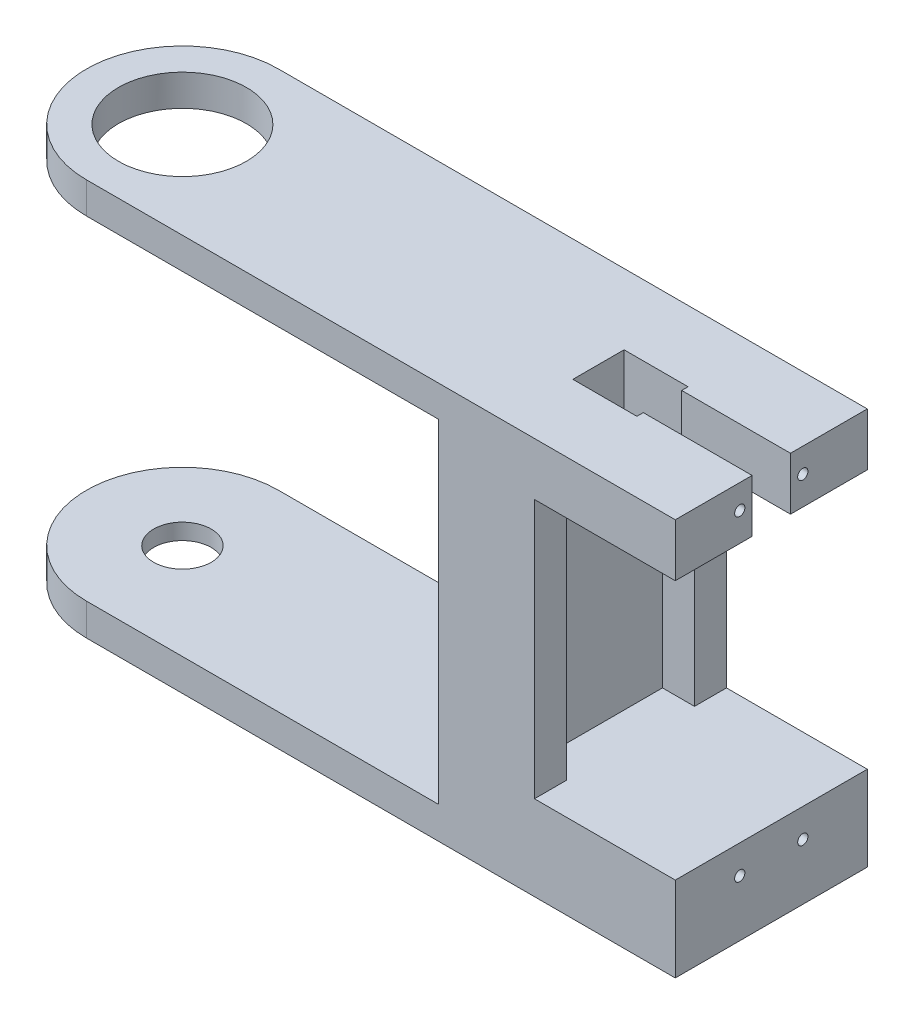
from build123d import *

# Parameters (mm, degrees)
ESQUISSE1_W               = 60.5
ESQUISSE1_H               = 64
BOSS_EXTRU_1_DEPTH        = 30
ESQUISSE2_R               = 4.5
ENL_V_MAT_EXTRU_1_DEPTH   = 32
ENL_V_MAT_EXTRU_2_REACH   = 55.283
ESQUISSE4_W               = 51.1
ESQUISSE4_H               = 83.557669167
ESQUISSE5_R               = 10.5
ENL_V_MAT_EXTRU_3_DEPTH   = 2
ESQUISSE6_R               = 10
ENL_V_MAT_EXTRU_4_DEPTH   = 4.7
ESQUISSE7_W               = 47
ESQUISSE7_H               = 57
BOSS_EXTRU_2_DEPTH        = 30
ENL_V_MAT_EXTRU_5_DEPTH   = 30
ENL_V_MAT_EXTRU_6_DEPTH   = 8.25
ESQUISSE11_W              = 5
ESQUISSE11_H              = 40.5
BOSS_EXTRU_3_DEPTH        = 5
ESQUISSE12_R              = 0.5
ENL_V_MAT_EXTRU_7_DEPTH   = 15
TROU_TARAUD_M2X0_42_D     = 1.6
TROU_TARAUD_M2X0_42_DEPTH = 17
TROU_TARAUD_M2X0_42_TIP   = 0.480688495
ENL_V_MAT_EXTRU_8_REACH   = 113.72
ESQUISSE22_W              = 82.97203866
ESQUISSE22_H              = 67.875780224
ENL_V_MAT_EXTRU_10_DEPTH  = 30
ESQUISSE23_W              = 55
ESQUISSE23_H              = 5
ESQUISSE23_H_2            = 4.9
BOSS_EXTRU_4_DEPTH        = 30
ENL_V_START               = -62
ESQUISSE24_R              = 10
ENL_V_MAT_EXTRU_11_DEPTH  = 62
ENL_V_MAT_EXTRU_12_REACH  = 111.597
ESQUISSE26_R              = 10.5
ESQUISSE26_R_2            = 4.5
BOSS_EXTRU_5_DEPTH        = 5
ESQUISSE27_R              = 10.5
ENL_V_MAT_EXTRU_13_DEPTH  = 2.5
ESQUISSE28_W              = 21.53784572
ESQUISSE28_H              = 33.22443827
ENL_V_MAT_EXTRU_14_DEPTH  = 5
ESQUISSE29_W              = 5
ESQUISSE29_H              = 52.1
ENL_V_MAT_EXTRU_15_DEPTH  = 30
BOSS_EXTRU_6_DEPTH        = 62
ENL_V_START_2             = -20.388398
ESQUISSE32_W              = 38.789198293
ESQUISSE32_H              = 52.1
ENL_V_MAT_EXTRU_16_DEPTH  = 20.388398
ESQUISSE36_W              = 70.879809572
ESQUISSE36_H              = 44.299384872
ENL_V_MAT_EXTRU_20_DEPTH  = 62
ESQUISSE37_W              = 30
ESQUISSE37_H              = 4.9
ESQUISSE37_H_2            = 5
BOSS_EXTRU_8_DEPTH        = 70
ENL_V_MAT_EXTRU_21_REACH  = 119.544
ESQUISSE38_R              = 4.5
ESQUISSE39_R              = 10
ENL_V_MAT_EXTRU_22_DEPTH  = 4.9
ESQUISSE40_R              = 10.5
ENL_V_MAT_EXTRU_23_DEPTH  = 2.5
ENL_V_MAT_EXTRU_24_REACH  = 119.544


with BuildPart() as part:
    # Esquisse1 → Boss.-Extru.1 (new body)
    with BuildSketch(Plane.XY):
        Rectangle(ESQUISSE1_W, ESQUISSE1_H)
    extrude(amount=BOSS_EXTRU_1_DEPTH)

    # Esquisse2 → Enlèv. mat.-Extru.1 (cut)
    with BuildSketch(Plane(origin=(30.25, 0, 0), x_dir=(0, 0, -1), z_dir=(1, 0, 0))):
        with Locations(Location((-15, -17, 0), (0, 0, 90))):
            Circle(ESQUISSE2_R)
    extrude(amount=-ENL_V_MAT_EXTRU_1_DEPTH, mode=Mode.SUBTRACT)

    # Enlèv. mat.-Extru.2: up to this face of the body (flat: up to its plane)
    enl_v_mat_extru_2_end = Plane(part.part.faces().sort_by_distance((0, 0, 0))[0])
    # Esquisse4 → Enlèv. mat.-Extru.2 (cut, up to the picked face)
    with BuildSketch(Plane.XY.offset(30), mode=Mode.PRIVATE) as enl_v_mat_extru_2_sk1:
        with Locations((0, -14.778834584)):
            Rectangle(ESQUISSE4_W, ESQUISSE4_H)
    enl_v_mat_extru_2_tool1 = split(extrude(enl_v_mat_extru_2_sk1.sketch, amount=-ENL_V_MAT_EXTRU_2_REACH, mode=Mode.PRIVATE), bisect_by=enl_v_mat_extru_2_end, keep=Keep.BOTH, mode=Mode.PRIVATE)
    add(enl_v_mat_extru_2_tool1.solids().sort_by(Axis((0, -14.778835, 30), (0, 0, -1)))[0], mode=Mode.SUBTRACT)

    # Esquisse5 → Enlèv. mat.-Extru.3 (cut)
    with BuildSketch(Plane(origin=(30.25, 0, 0), x_dir=(0, 0, -1), z_dir=(1, 0, 0))):
        with Locations(Location((-15, -17, 0), (0, 0, 90))):
            Circle(ESQUISSE5_R)
    extrude(amount=-ENL_V_MAT_EXTRU_3_DEPTH, mode=Mode.SUBTRACT)

    # Esquisse6 → Enlèv. mat.-Extru.4 (cut)
    with BuildSketch(Plane(origin=(-25.55, 0, 0), x_dir=(0, 0, -1), z_dir=(1, 0, 0))):
        with Locations((-15, -17)):
            Circle(ESQUISSE6_R)
    extrude(amount=-ENL_V_MAT_EXTRU_4_DEPTH, mode=Mode.SUBTRACT)

    # Esquisse7 → Boss.-Extru.2 (add)
    with BuildSketch(Plane.XY.offset(30)):
        with Locations((-6.75, 60.5)):
            Rectangle(ESQUISSE7_W, ESQUISSE7_H)
    extrude(amount=-BOSS_EXTRU_2_DEPTH)

    # Esquisse8 → Enlèv. mat.-Extru.5 (cut)
    with BuildSketch(Plane.XY.offset(30)):
        Polygon((-15.25, 80.75), (11.75, 80.75), (11.75, 101.149817475), (21.75, 101.149817475), (21.75, 32), (11.75, 32), (11.75, 40.25), (-15.25, 40.25), align=None)
    extrude(amount=-ENL_V_MAT_EXTRU_5_DEPTH, mode=Mode.SUBTRACT)

    # Esquisse10 → Enlèv. mat.-Extru.6 (cut)
    with BuildSketch(Plane.XZ.offset(-80.75)):
        Polygon((-5.25, 11), (-5.25, 12), (34.75, 12), (34.75, 18), (-5.25, 18), (-5.25, 19), (-15.25, 19), (-15.25, 11), align=None)
    extrude(amount=-ENL_V_MAT_EXTRU_6_DEPTH, mode=Mode.SUBTRACT)

    # Esquisse11 → Boss.-Extru.3 (add)
    with BuildSketch(Plane(origin=(-15.25, 0, 0), x_dir=(0, 0, -1), z_dir=(1, 0, 0))):
        with Locations((-27.5, 60.5)):
            Rectangle(ESQUISSE11_W, ESQUISSE11_H)
        with Locations((-2.5, 60.5)):
            Rectangle(ESQUISSE11_W, ESQUISSE11_H)
    extrude(amount=BOSS_EXTRU_3_DEPTH)

    # Esquisse12 → Enlèv. mat.-Extru.7 (cut)
    with BuildSketch(Plane(origin=(11.75, 0, 0), x_dir=(0, 0, -1), z_dir=(1, 0, 0))):
        with Locations((-19.925, 85.21)):
            Circle(ESQUISSE12_R)
        with Locations(Location((-10.075, 85.21, 0), (0, 0, 180))):
            Circle(ESQUISSE12_R)
        with Locations((-10.075, 35.79)):
            Circle(ESQUISSE12_R)
        with Locations(Location((-19.925, 35.79, 0), (0, 0, 180))):
            Circle(ESQUISSE12_R)
    extrude(amount=-ENL_V_MAT_EXTRU_7_DEPTH, mode=Mode.SUBTRACT)

    # Trou taraudé M2x0.42
    with Locations(Plane(origin=(11.75, 85.21, 19.925), x_dir=(0, 0, 1), z_dir=(1, 0, 0))):
        with Locations((0, 0), (-9.85, 0), (-9.85, 49.42), (0, 49.42)):
            Hole(TROU_TARAUD_M2X0_42_D / 2, depth=TROU_TARAUD_M2X0_42_DEPTH)
            with Locations((0, 0, -(TROU_TARAUD_M2X0_42_DEPTH + TROU_TARAUD_M2X0_42_TIP / 2))):  # 118° drill point
                Cone(0, TROU_TARAUD_M2X0_42_D / 2, TROU_TARAUD_M2X0_42_TIP, mode=Mode.SUBTRACT)

    # Enlèv. mat.-Extru.8: up to this face of the body (flat: up to its plane)
    enl_v_mat_extru_8_end = Plane(part.part.faces().sort_by_distance((30.25, 3.741727612, 15))[0])
    # Esquisse15 → Enlèv. mat.-Extru.8 (cut, up to the picked face)
    with BuildSketch(Plane.ZY.offset(30.25), mode=Mode.PRIVATE) as enl_v_mat_extru_8_sk1:
        with BuildLine():
            Line((40, -17), (30, -17))
            ThreePointArc((30, -17), (15, -32), (0, -17))
            Line((0, -17), (-10, -17))
            ThreePointArc((-10, -17), (15, -42), (40, -17))
        make_face()
    enl_v_mat_extru_8_tool1 = split(extrude(enl_v_mat_extru_8_sk1.sketch, amount=-ENL_V_MAT_EXTRU_8_REACH, mode=Mode.PRIVATE), bisect_by=enl_v_mat_extru_8_end, keep=Keep.BOTH, mode=Mode.PRIVATE)
    add(enl_v_mat_extru_8_tool1.solids().sort_by(Axis((-30.25, -17.559017, -5), (1, 0, 0)))[0], mode=Mode.SUBTRACT)

    # Esquisse22 → Enlèv. mat.-Extru.10 (cut)
    with BuildSketch(Plane.XY.offset(30)):
        with Locations((-1.917421061, -6.937890112)):
            Rectangle(ESQUISSE22_W, ESQUISSE22_H)
    extrude(amount=-ENL_V_MAT_EXTRU_10_DEPTH, mode=Mode.SUBTRACT)

    # Esquisse23 → Boss.-Extru.4 (add)
    with BuildSketch(Plane(origin=(0, 0, 0), x_dir=(-1, 0, 0), z_dir=(0, 0, -1))):
        with Locations((57.75, 29.5)):
            Rectangle(ESQUISSE23_W, ESQUISSE23_H)
        with Locations((57.75, 86.55)):
            Rectangle(ESQUISSE23_W, ESQUISSE23_H_2)
    extrude(amount=-BOSS_EXTRU_4_DEPTH)

    # Esquisse24 → Enlèv. mat.-Extru.11 (cut)
    with BuildSketch(Plane.XZ.offset(-27).offset(ENL_V_START)):
        with Locations((-74.25, 15)):
            Circle(ESQUISSE24_R)
    extrude(amount=ENL_V_MAT_EXTRU_11_DEPTH, mode=Mode.SUBTRACT)

    # Enlèv. mat.-Extru.12: up to this face of the body (flat: up to its plane)
    enl_v_mat_extru_12_end = Plane(part.part.faces().sort_by_distance((-34.437928466, 89, 15))[0])
    # Esquisse25 → Enlèv. mat.-Extru.12 (cut, up to the picked face)
    with BuildSketch(Plane.XZ.offset(-27), mode=Mode.PRIVATE) as enl_v_mat_extru_12_sk1:
        with BuildLine():
            Line((-74.25, 44.134833893), (-74.25, 30))
            ThreePointArc((-74.25, 30), (-89.25, 15), (-74.25, 0))
            Line((-74.25, 0), (-74.25, -14.134833893))
            ThreePointArc((-74.25, -14.134833893), (-103.384833893, 15), (-74.25, 44.134833893))
        make_face()
    enl_v_mat_extru_12_tool1 = split(extrude(enl_v_mat_extru_12_sk1.sketch, amount=-ENL_V_MAT_EXTRU_12_REACH, mode=Mode.PRIVATE), bisect_by=enl_v_mat_extru_12_end, keep=Keep.BOTH, mode=Mode.PRIVATE)
    add(enl_v_mat_extru_12_tool1.solids().sort_by(Axis((-74.901475, 27, 37.067417), (0, 1, 0)))[0], mode=Mode.SUBTRACT)

    # Esquisse26 → Boss.-Extru.5 (add)
    with BuildSketch(Plane.XZ.offset(-27)):
        with Locations((-74.25, 15)):
            Circle(ESQUISSE26_R)
        with Locations((-74.25, 15)):
            Circle(ESQUISSE26_R_2, mode=Mode.SUBTRACT)
    extrude(amount=-BOSS_EXTRU_5_DEPTH)

    # Esquisse27 → Enlèv. mat.-Extru.13 (cut)
    with BuildSketch(Plane.XZ.offset(-27)):
        with Locations((-74.25, 15)):
            Circle(ESQUISSE27_R)
    extrude(amount=-ENL_V_MAT_EXTRU_13_DEPTH, mode=Mode.SUBTRACT)

    # Esquisse28 → Enlèv. mat.-Extru.14 (cut)
    with BuildSketch(Plane(origin=(0, 32, 0), x_dir=(1, 0, 0), z_dir=(0, 1, 0))):
        with Locations((22.51892286, -16.612219135)):
            Rectangle(ESQUISSE28_W, ESQUISSE28_H)
    extrude(amount=-ENL_V_MAT_EXTRU_14_DEPTH, mode=Mode.SUBTRACT)

    # Esquisse29 → Enlèv. mat.-Extru.15 (cut)
    with BuildSketch(Plane(origin=(0, 0, 0), x_dir=(-1, 0, 0), z_dir=(0, 0, -1))):
        with Locations((27.75, 58.05)):
            Rectangle(ESQUISSE29_W, ESQUISSE29_H)
    extrude(amount=-ENL_V_MAT_EXTRU_15_DEPTH, mode=Mode.SUBTRACT)

    # Esquisse31 → Boss.-Extru.6 (add)
    with BuildSketch(Plane.XZ.offset(-27)):
        with BuildLine():
            ThreePointArc((-74.826036871, 4.515812787), (-83.84709586, 10.740217019), (-82.411654216, 21.605861069))
            Line((-82.411654216, 21.605861069), (-85.25, 25.198039027))
            Line((-85.25, 25.198039027), (-85.25, 4.801960973))
            Line((-85.25, 4.801960973), (-74.826036871, 4.515812787))
        make_face()
        with BuildLine():
            ThreePointArc((-85.25, 25.198039027), (-89.25, 15), (-85.25, 4.801960973))
            Line((-85.25, 4.801960973), (-85.25, 25.198039027))
        make_face()
    extrude(amount=-BOSS_EXTRU_6_DEPTH)

    # Esquisse32 → Enlèv. mat.-Extru.16 (cut)
    with BuildSketch(Plane(origin=(0.067526976, 0, 2.459909751), x_dir=(-0.9996234341769173, 0, 0.027440660421105302), z_dir=(-0.027440660421105302, 0, -0.9996234341769173)).offset(ENL_V_START_2)):
        with Locations((94.316375975, 58.05)):
            Rectangle(ESQUISSE32_W, ESQUISSE32_H)
    extrude(amount=ENL_V_MAT_EXTRU_16_DEPTH, mode=Mode.SUBTRACT)

    # Esquisse36 → Enlèv. mat.-Extru.20 (cut)
    with BuildSketch(Plane.XZ.offset(-27)):
        with Locations((-60.689904786, 17.333529037)):
            Rectangle(ESQUISSE36_W, ESQUISSE36_H)
    extrude(amount=-ENL_V_MAT_EXTRU_20_DEPTH, mode=Mode.SUBTRACT)

    # Esquisse37 → Boss.-Extru.8 (add)
    with BuildSketch(Plane.ZY.offset(25.25)):
        with Locations((15, 86.55)):
            Rectangle(ESQUISSE37_W, ESQUISSE37_H)
        with Locations((15, 29.5)):
            Rectangle(ESQUISSE37_W, ESQUISSE37_H_2)
    extrude(amount=BOSS_EXTRU_8_DEPTH)

    # Enlèv. mat.-Extru.21: up to this face of the body (flat: up to its plane)
    enl_v_mat_extru_21_end = Plane(part.part.faces().sort_by_distance((-44.098084544, 89, 15))[0])
    # Esquisse38 → Enlèv. mat.-Extru.21 (cut, up to the picked face)
    with BuildSketch(Plane.XZ.offset(-27), mode=Mode.PRIVATE) as enl_v_mat_extru_21_sk1:
        with Locations((-80.25, 15)):
            Circle(ESQUISSE38_R)
    enl_v_mat_extru_21_tool1 = split(extrude(enl_v_mat_extru_21_sk1.sketch, amount=-ENL_V_MAT_EXTRU_21_REACH, mode=Mode.PRIVATE), bisect_by=enl_v_mat_extru_21_end, keep=Keep.BOTH, mode=Mode.PRIVATE)
    add(enl_v_mat_extru_21_tool1.solids().sort_by(Axis((-80.25, 27, 15), (0, 1, 0)))[0], mode=Mode.SUBTRACT)

    # Esquisse39 → Enlèv. mat.-Extru.22 (cut)
    with BuildSketch(Plane(origin=(0, 89, 0), x_dir=(1, 0, 0), z_dir=(0, 1, 0))):
        with Locations(Location((-80.25, -15, 0), (0, 0, 270))):
            Circle(ESQUISSE39_R)
    extrude(amount=-ENL_V_MAT_EXTRU_22_DEPTH, mode=Mode.SUBTRACT)

    # Esquisse40 → Enlèv. mat.-Extru.23 (cut)
    with BuildSketch(Plane.XZ.offset(-27)):
        with Locations((-80.25, 15)):
            Circle(ESQUISSE40_R)
    extrude(amount=-ENL_V_MAT_EXTRU_23_DEPTH, mode=Mode.SUBTRACT)

    # Enlèv. mat.-Extru.24: up to this face of the body (flat: up to its plane)
    enl_v_mat_extru_24_end = Plane(part.part.faces().sort_by_distance((-39.91307138, 89, 15))[0])
    # Esquisse42 → Enlèv. mat.-Extru.24 (cut, up to the picked face)
    with BuildSketch(Plane.XZ.offset(-27), mode=Mode.PRIVATE) as enl_v_mat_extru_24_sk1:
        with BuildLine():
            Line((-80.25, 38.922928663), (-80.25, 30))
            ThreePointArc((-80.25, 30), (-95.25, 15), (-80.25, 0))
            Line((-80.25, 0), (-80.25, -8.922928663))
            ThreePointArc((-80.25, -8.922928663), (-104.172928663, 15), (-80.25, 38.922928663))
        make_face()
    enl_v_mat_extru_24_tool1 = split(extrude(enl_v_mat_extru_24_sk1.sketch, amount=-ENL_V_MAT_EXTRU_24_REACH, mode=Mode.PRIVATE), bisect_by=enl_v_mat_extru_24_end, keep=Keep.BOTH, mode=Mode.PRIVATE)
    add(enl_v_mat_extru_24_tool1.solids().sort_by(Axis((-80.784933, 27, 34.461464), (0, 1, 0)))[0], mode=Mode.SUBTRACT)


solid = part.part
